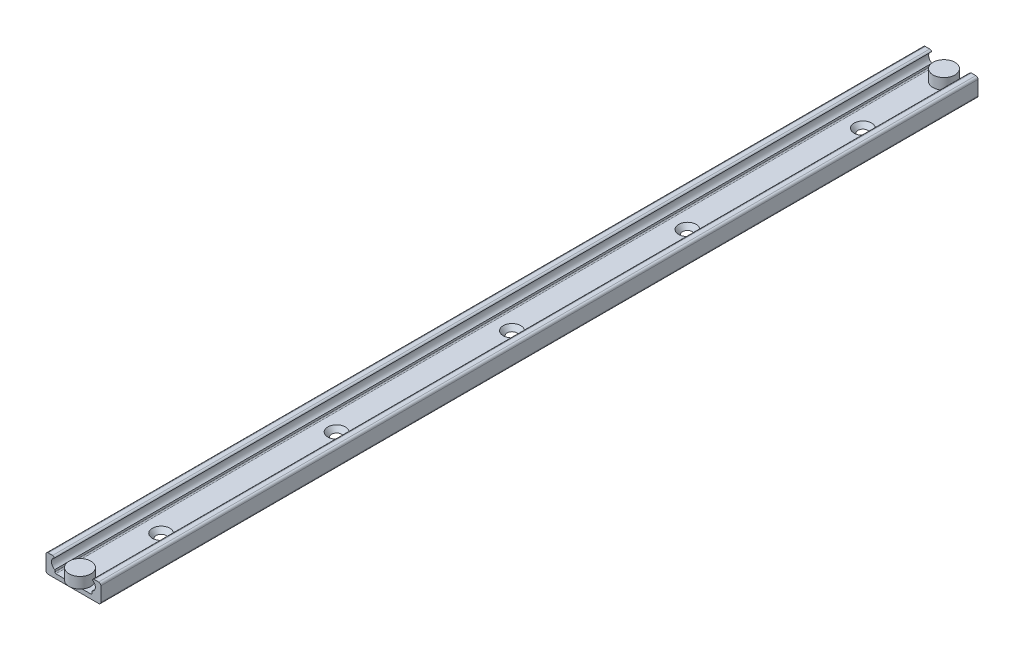
from build123d import *

# Parameters (mm, degrees)
BOSS_EXTRUDE1_DEPTH = 400
SKETCH7_R           = 5
BOSS_EXTRUDE2_DEPTH = 5
SKETCH8_R           = 5
BOSS_EXTRUDE3_DEPTH = 5


with BuildPart() as part:
    # Sketch1 → Boss-Extrude1 (new body)
    with BuildSketch(Plane.XY):
        with BuildLine():
            Line((-11.5, 0), (11.5, 0))
            ThreePointArc((11.5, 0), (12.207106781, 0.292893219), (12.5, 1))
            Line((12.5, 1), (12.5, 7.5))
            ThreePointArc((12.5, 7.5), (12.207106781, 8.207106781), (11.5, 8.5))
            Line((11.5, 8.5), (9.5, 8.5))
            ThreePointArc((9.5, 8.5), (8.97237829, 8.349479447), (8.603592403, 7.943230663))
            ThreePointArc((8.603592403, 7.943230663), (9.999347871, 5.642901666), (8.5, 3.408712153))
            Line((8.5, 3.408712153), (8.5, 2.5))
            ThreePointArc((8.5, 2.5), (8.353553391, 2.146446609), (8, 2))
            Line((8, 2), (-8, 2))
            ThreePointArc((-8, 2), (-8.353553391, 2.146446609), (-8.5, 2.5))
            Line((-8.5, 2.5), (-8.5, 3.408712153))
            ThreePointArc((-8.5, 3.408712153), (-9.999347871, 5.642901666), (-8.603592403, 7.943230663))
            ThreePointArc((-8.603592403, 7.943230663), (-8.97237829, 8.349479447), (-9.5, 8.5))
            Line((-9.5, 8.5), (-11.5, 8.5))
            ThreePointArc((-11.5, 8.5), (-12.207106781, 8.207106781), (-12.5, 7.5))
            Line((-12.5, 7.5), (-12.5, 1))
            ThreePointArc((-12.5, 1), (-12.207106781, 0.292893219), (-11.5, 0))
        make_face()
    extrude(amount=BOSS_EXTRUDE1_DEPTH)

    # Sketch2 → Cut-Revolve1 (revolve, cut)
    with BuildSketch(Plane.XY.offset(40), mode=Mode.PRIVATE) as cut_revolve1_sk:
        Polygon((0, 2), (4, 2), (2.25, 0), (0, 0), align=None)
    revolve(cut_revolve1_sk.sketch.rotate(Axis((0, 0, 40), (0, 1, 0)), 270), axis=Axis((0, 0, 40), (0, 1, 0)), mode=Mode.SUBTRACT)

    # Sketch3 → Cut-Revolve2 (revolve, cut)
    with BuildSketch(Plane.XY.offset(120), mode=Mode.PRIVATE) as cut_revolve2_sk:
        Polygon((0, 2), (4, 2), (2.25, 0), (0, 0), align=None)
    revolve(cut_revolve2_sk.sketch.rotate(Axis((0, 0, 120), (0, 1, 0)), 270), axis=Axis((0, 0, 120), (0, 1, 0)), mode=Mode.SUBTRACT)

    # Sketch4 → Cut-Revolve3 (revolve, cut)
    with BuildSketch(Plane.XY.offset(200), mode=Mode.PRIVATE) as cut_revolve3_sk:
        Polygon((0, 2), (4, 2), (2.25, 0), (0, 0), align=None)
    revolve(cut_revolve3_sk.sketch.rotate(Axis((0, 0, 200), (0, 1, 0)), 270), axis=Axis((0, 0, 200), (0, 1, 0)), mode=Mode.SUBTRACT)

    # Sketch5 → Cut-Revolve4 (revolve, cut)
    with BuildSketch(Plane.XY.offset(280), mode=Mode.PRIVATE) as cut_revolve4_sk:
        Polygon((0, 2), (4, 2), (2.25, 0), (0, 0), align=None)
    revolve(cut_revolve4_sk.sketch.rotate(Axis((0, 0, 280), (0, 1, 0)), 270), axis=Axis((0, 0, 280), (0, 1, 0)), mode=Mode.SUBTRACT)

    # Sketch6 → Cut-Revolve5 (revolve, cut)
    with BuildSketch(Plane.XY.offset(360), mode=Mode.PRIVATE) as cut_revolve5_sk:
        Polygon((0, 2), (4, 2), (2.25, 0), (0, 0), align=None)
    revolve(cut_revolve5_sk.sketch.rotate(Axis((0, 0, 360), (0, 1, 0)), 270), axis=Axis((0, 0, 360), (0, 1, 0)), mode=Mode.SUBTRACT)

    # Sketch7 → Boss-Extrude2 (add)
    with BuildSketch(Plane(origin=(0, 2, 0), x_dir=(1, 0, 0), z_dir=(0, 1, 0))):
        with Locations(Location((0, -3, 0), (0, 0, 143.130102354))):
            Circle(SKETCH7_R)
    extrude(amount=BOSS_EXTRUDE2_DEPTH)

    # Sketch8 → Boss-Extrude3 (add)
    with BuildSketch(Plane(origin=(0, 2, 0), x_dir=(1, 0, 0), z_dir=(0, 1, 0))):
        with Locations(Location((0, -397, 0), (0, 0, 216.869897646))):
            Circle(SKETCH8_R)
    extrude(amount=BOSS_EXTRUDE3_DEPTH)


solid = part.part
